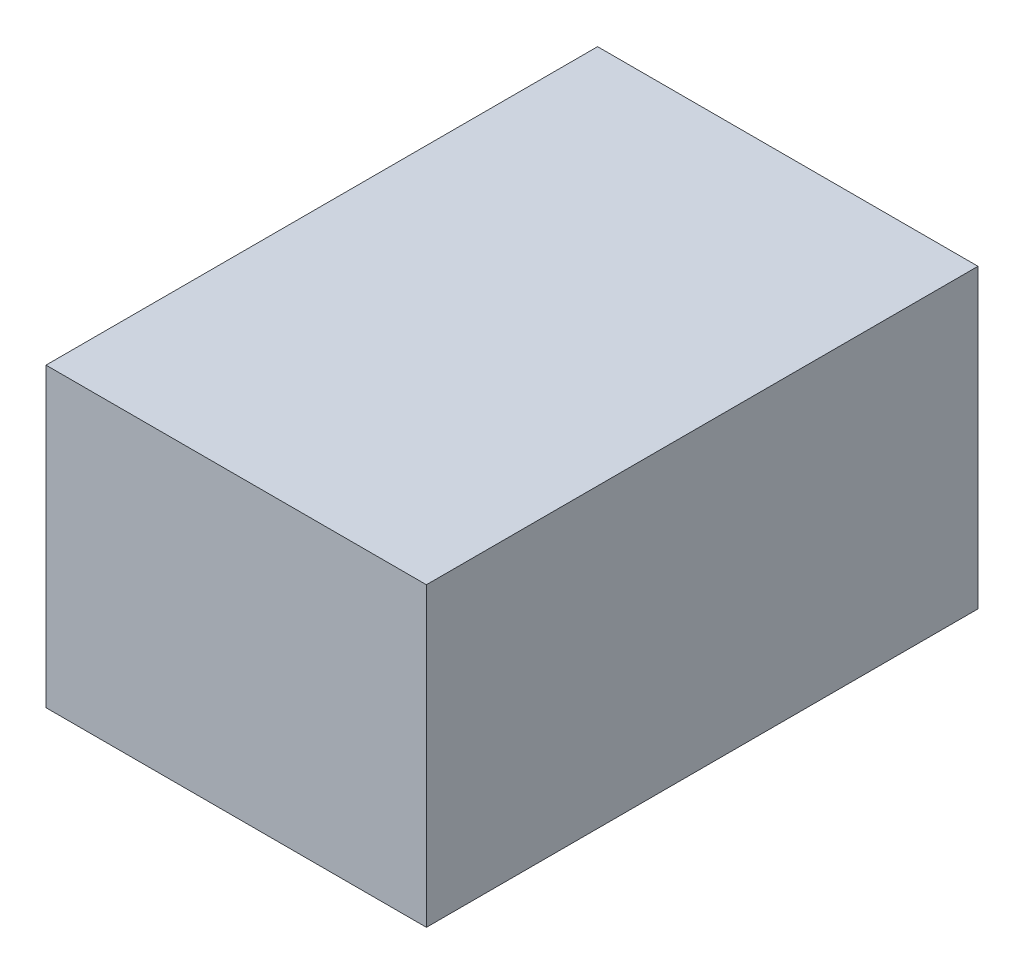
from build123d import *

# Parameters (mm, degrees)
IZIM1_W                     = 100
IZIM1_H                     = 145
Y_KSEKLIK_EKSTR_ZYON1_DEPTH = 78


with BuildPart() as part:
    # Çizim1 → Yükseklik-Ekstrüzyon1 (new body)
    with BuildSketch(Plane(origin=(0, 0, 0), x_dir=(1, 0, 0), z_dir=(0, 1, 0))):
        Rectangle(IZIM1_W, IZIM1_H)
    extrude(amount=Y_KSEKLIK_EKSTR_ZYON1_DEPTH)


solid = part.part
